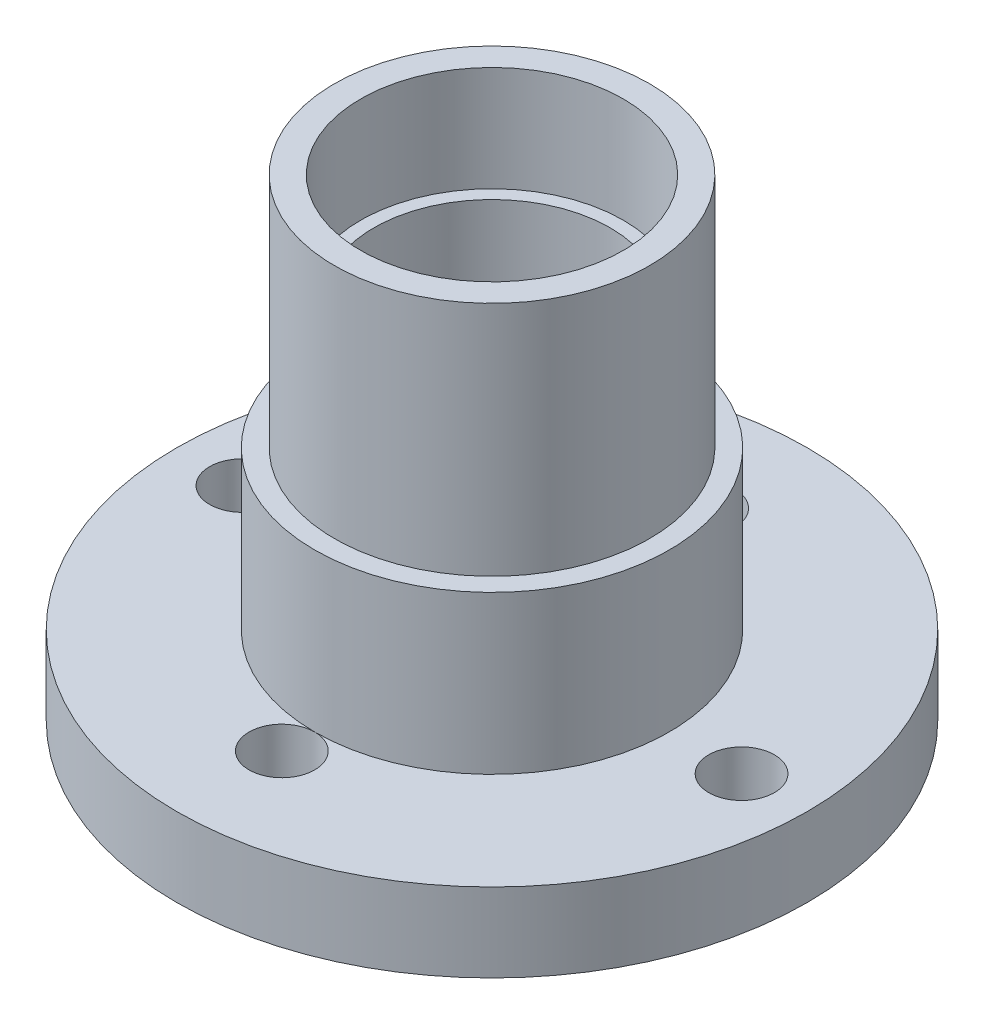
from build123d import *

# Parameters (mm, degrees)
SKETCH3_R          = 1.25
CUT_EXTRUDE1_DEPTH = 6


with BuildPart() as part:
    # Sketch2 → Revolve1 (revolve)
    with BuildSketch(Plane.XY, mode=Mode.PRIVATE) as revolve1_sk:
        Polygon((-12, 0), (-5, 0), (-5, 4), (-4.5, 4), (-4.5, 14), (-5, 14), (-5, 18), (-6, 18), (-6, 9), (-6.75, 9), (-6.75, 3), (-12, 3), align=None)
    revolve(revolve1_sk.sketch.rotate(Axis((0, 0, 0), (0, 1, 0)), 270), axis=Axis((0, 0, 0), (0, 1, 0)))

    # Sketch3 → Cut-Extrude1 (cut)
    with BuildSketch(Plane.XZ):
        with Locations(Location((0, 8, 0), (0, 0, 270))):
            Circle(SKETCH3_R)
        with Locations(Location((9.5, 0, 0), (0, 0, 270))):
            Circle(SKETCH3_R)
        with Locations(Location((0, -8, 0), (0, 0, 270))):
            Circle(SKETCH3_R)
        with Locations(Location((-9.5, 0, 0), (0, 0, 270))):
            Circle(SKETCH3_R)
    extrude(amount=-CUT_EXTRUDE1_DEPTH, mode=Mode.SUBTRACT)


solid = part.part
